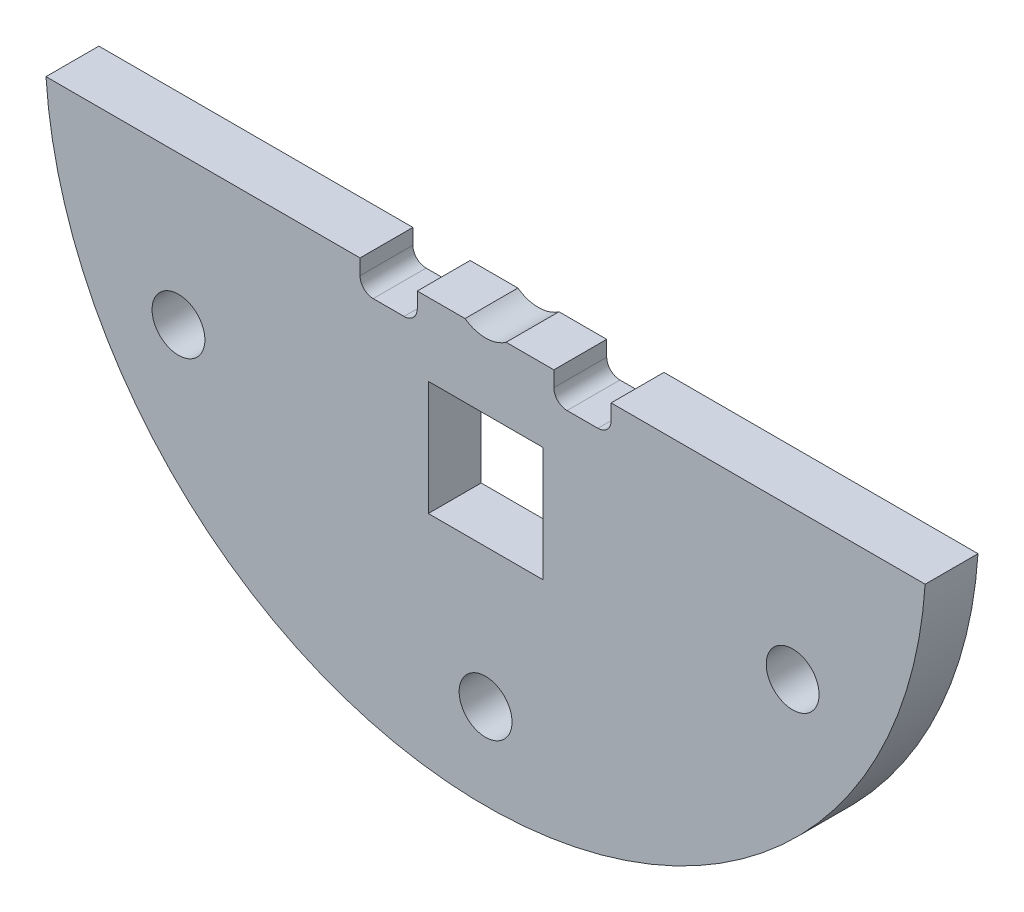
from build123d import *

# Parameters (mm, degrees)
MODEL_R                 = 1.5
MODEL_W                 = 6.5
MODEL_H                 = 6.5
SALIENTE_EXTRUIR1_DEPTH = 3


with BuildPart() as part:
    # Model → Saliente-Extruir1 (new body)
    with BuildSketch(Plane.XY):
        with BuildLine():
            Line((191.396871733, 188.964281637), (194.105949351, 188.964281637))
            Line((194.105949351, 188.964281637), (194.105949351, 188.089281637))
            ThreePointArc((194.105949351, 188.089281637), (194.325619265, 187.558951551), (194.855949351, 187.339281637))
            Line((194.855949351, 187.339281637), (196.605949351, 187.339281637))
            ThreePointArc((196.605949351, 187.339281637), (197.136279437, 187.558951551), (197.355949351, 188.089281637))
            Line((197.355949351, 188.089281637), (197.355949351, 188.964281637))
            Line((197.355949351, 188.964281637), (215.17808095, 188.964281637))
            ThreePointArc((215.17808095, 188.964281637), (208.476468276, 173.498317967), (193.480949351, 165.80143179))
            ThreePointArc((193.480949351, 165.80143179), (174.362087289, 171.27143453), (165.283817753, 188.964281637))
            Line((165.283817753, 188.964281637), (183.105949351, 188.964281637))
            Line((183.105949351, 188.964281637), (183.105949351, 188.089281637))
            ThreePointArc((183.105949351, 188.089281637), (183.325619265, 187.558951551), (183.855949351, 187.339281637))
            Line((183.855949351, 187.339281637), (185.605949351, 187.339281637))
            ThreePointArc((185.605949351, 187.339281637), (186.136279437, 187.558951551), (186.355949351, 188.089281637))
            Line((186.355949351, 188.089281637), (186.355949351, 188.964281637))
            Line((186.355949351, 188.964281637), (189.06502697, 188.964281637))
            ThreePointArc((189.06502697, 188.964281637), (190.230949351, 188.589281637), (191.396871733, 188.964281637))
        make_face()
        with Locations((172.802524293, 180.526975738)):
            Circle(MODEL_R, mode=Mode.SUBTRACT)
        with Locations((190.230949351, 170.464669839)):
            Circle(MODEL_R, mode=Mode.SUBTRACT)
        with Locations((207.659374409, 180.526975738)):
            Circle(MODEL_R, mode=Mode.SUBTRACT)
        with Locations((190.230949351, 181.589281637)):
            Rectangle(MODEL_W, MODEL_H, mode=Mode.SUBTRACT)
    extrude(amount=SALIENTE_EXTRUIR1_DEPTH)


solid = part.part
